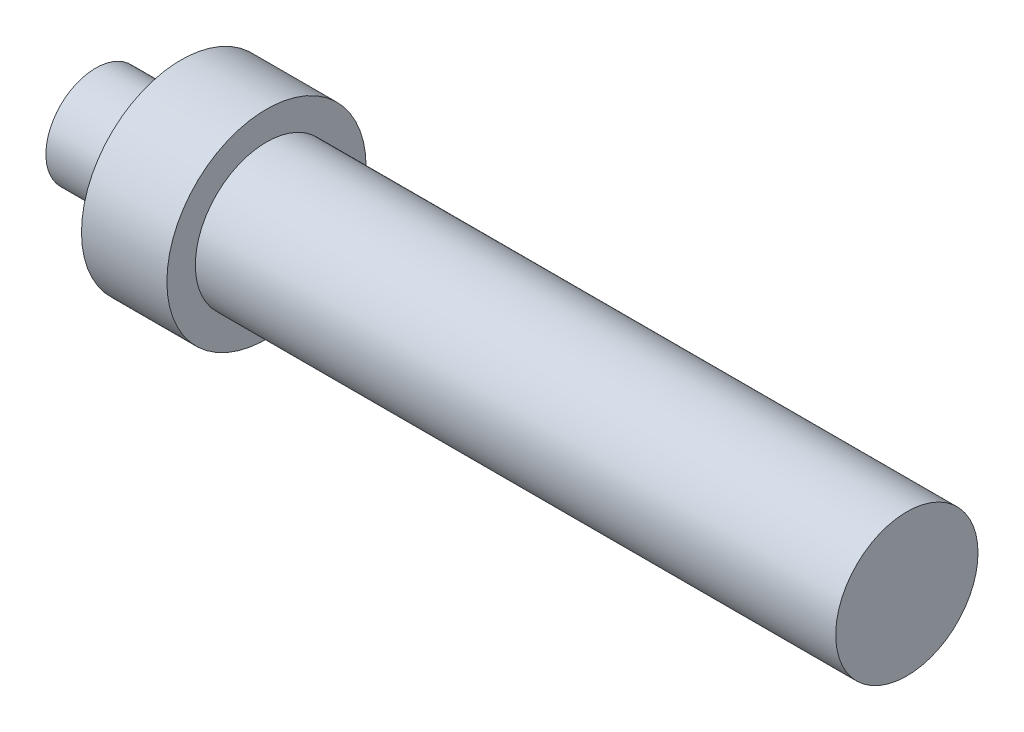
from build123d import *


with BuildPart() as part:
    # Sketch1 → Revolve1 (revolve)
    with BuildSketch(Plane.XY, mode=Mode.PRIVATE) as revolve1_sk:
        Polygon((28.5, 0), (-28.5, 0), (-28.5, 3.5), (-22.5, 3.5), (-22.5, 7), (-16.5, 7), (-16.5, 5), (28.5, 5), align=None)
    revolve(revolve1_sk.sketch.rotate(Axis((28.5, 0, 0), (-1, 0, 0)), 90), axis=Axis((28.5, 0, 0), (-1, 0, 0)))


solid = part.part
